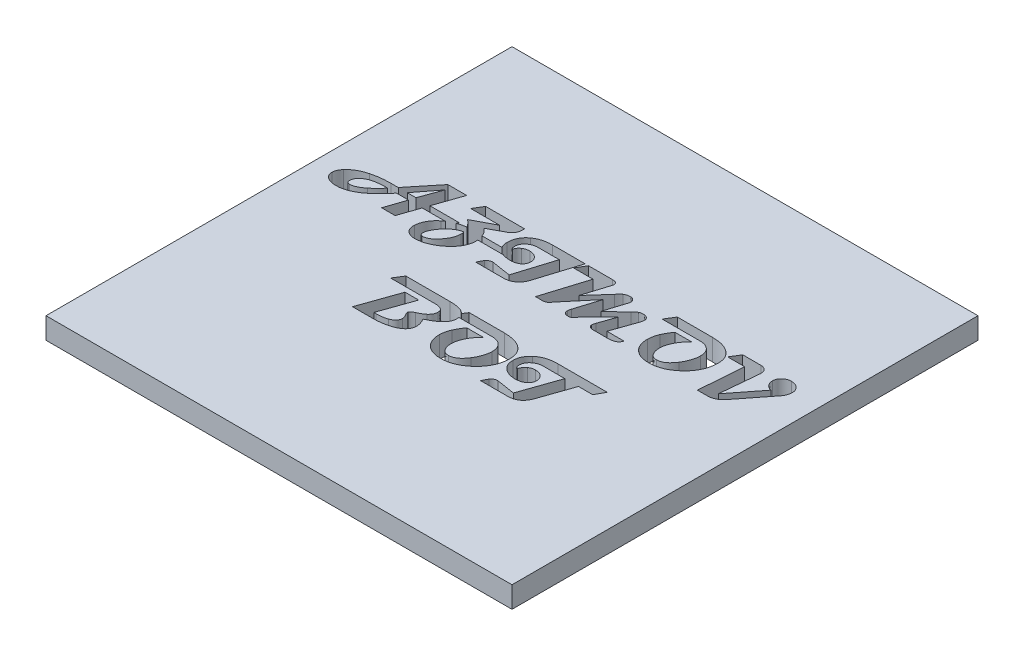
from build123d import *

# Parameters (mm, degrees)
SKETCH_1_W          = 70
SKETCH_1_H          = 70
EXTRUDE_1_DEPTH     = 3.2
CUT_EXTRUDE_1_DEPTH = 3.2


with BuildPart() as part:
    # Эскиз1 → Бобышка-Вытянуть1 (new body)
    with BuildSketch(Plane(origin=(0, 0, 0), x_dir=(1, 0, 0), z_dir=(0, 1, 0))):
        Rectangle(SKETCH_1_W, SKETCH_1_H)
    extrude(amount=EXTRUDE_1_DEPTH)

    # Эскиз2 → Вырез-Вытянуть1 (cut)
    # profile 1 of 9: a face of its own
    with BuildSketch(Plane(origin=(0, 3.2, 0), x_dir=(1, 0, 0), z_dir=(0, 1, 0))):
        with BuildLine():
            add(Edge.make_bspline(
                [(-16.070392755, 8.135936371), (-16.096364615, 8.067361627), (-16.14673298, 7.934371619), (-16.25688386, 7.755695304), (-16.392095575, 7.604144329), (-16.553611031, 7.481302452), (-16.739373402, 7.3854735), (-16.950050176, 7.318683404), (-17.185372254, 7.277876665), (-17.350621164, 7.273406638), (-17.436946809, 7.271071506)],
                knots=[0, 0, 0, 0, 1.006722508, 1.952381103, 2.868174824, 3.7851138, 4.727214408, 5.728830785, 6.813546489, 8, 8, 8, 8], degree=3))
            Line((-17.436946809, 7.271071506), (-20.764649512, 7.271071506))
            Line((-20.764649512, 7.271071506), (-21.800122485, 4.244044479))
            Line((-21.800122485, 4.244044479), (-23.83221708, 4.244044479))
            Line((-23.83221708, 4.244044479), (-22.822081945, 7.271071506))
            Line((-22.822081945, 7.271071506), (-24.616000863, 7.271071506))
            add(Edge.make_bspline(
                [(-24.616000863, 7.271071506), (-24.733291603, 7.126132066), (-24.963048462, 6.842215103), (-25.317200669, 6.437982351), (-25.669386122, 6.061132511), (-26.021448787, 5.712842684), (-26.370467295, 5.390492302), (-26.720900496, 5.098571771), (-27.06841922, 4.831687155), (-27.417180907, 4.595572505), (-27.76335683, 4.38420989), (-28.110099538, 4.204402642), (-28.454140935, 4.047909568), (-28.798711689, 3.924258971), (-29.141798242, 3.823789581), (-29.484454242, 3.756055761), (-29.825940841, 3.710825136), (-30.053358908, 3.705938731), (-30.166676539, 3.703503938)],
                knots=[0, 0, 0, 0, 1.312287539, 2.570595627, 3.781888327, 4.942114945, 6.055705992, 7.124890043, 8.151404632, 9.138534534, 10.088072082, 11.004553681, 11.886233988, 12.746288506, 13.579214241, 14.40000118, 15.202754299, 16, 16, 16, 16], degree=3))
            add(Edge.make_bspline(
                [(-30.166676539, 3.703503938), (-30.293097011, 3.706506954), (-30.537210247, 3.712305666), (-30.886958877, 3.772561189), (-31.209419805, 3.860532159), (-31.402158359, 3.957118713), (-31.496068431, 4.004179614)],
                knots=[0, 0, 0, 0, 1.100618603, 2.125253648, 3.086547243, 4, 4, 4, 4], degree=3))
            add(Edge.make_bspline(
                [(-31.496068431, 4.004179614), (-31.550377502, 4.036728113), (-31.655564165, 4.099768557), (-31.795846337, 4.212225086), (-31.913138131, 4.336792675), (-32.011473624, 4.471022393), (-32.086078885, 4.618525728), (-32.140626612, 4.776921326), (-32.173333955, 4.94709535), (-32.176754542, 5.064283619), (-32.178500863, 5.124112047)],
                knots=[0, 0, 0, 0, 1.098347453, 2.127296654, 3.109202029, 4.061465577, 5.005768685, 5.967169859, 6.962174006, 8, 8, 8, 8], degree=3))
            add(Edge.make_bspline(
                [(-32.178500863, 5.124112047), (-32.176778369, 5.176569147), (-32.173334772, 5.281440997), (-32.148360307, 5.438056632), (-32.110017772, 5.593892482), (-32.053838186, 5.748432435), (-31.979671715, 5.900390977), (-31.893573678, 6.053577227), (-31.790635106, 6.205953668), (-31.710860768, 6.302677036), (-31.670054918, 6.352152587)],
                knots=[0, 0, 0, 0, 0.927183382, 1.853618216, 2.797696976, 3.761361177, 4.754352939, 5.784189041, 6.866577215, 8, 8, 8, 8], degree=3))
            add(Edge.make_bspline(
                [(-31.670054918, 6.352152587), (-31.598882404, 6.431295876), (-31.45458854, 6.591749545), (-31.207741783, 6.808731909), (-30.935288661, 7.010347653), (-30.638581826, 7.198360701), (-30.312983342, 7.36647834), (-29.963279839, 7.522484008), (-29.585935663, 7.660743558), (-29.323112092, 7.738197991), (-29.188635999, 7.777828263)],
                knots=[0, 0, 0, 0, 0.879074717, 1.78222015, 2.7101424, 3.678446659, 4.68172323, 5.735859223, 6.841531581, 8, 8, 8, 8], degree=3))
            add(Edge.make_bspline(
                [(-29.188635999, 7.777828263), (-29.079061436, 7.806892131), (-28.858136731, 7.865490829), (-28.520353912, 7.937222236), (-28.174334669, 7.997961558), (-27.820079942, 8.049012468), (-27.456564752, 8.087098107), (-27.084856298, 8.116192066), (-26.704567799, 8.133423024), (-26.448225444, 8.135092723), (-26.318703566, 8.135936371)],
                knots=[0, 0, 0, 0, 0.937796571, 1.890789484, 2.855809912, 3.844029335, 4.851323956, 5.879251624, 6.928451321, 8, 8, 8, 8], degree=3))
            Line((-26.318703566, 8.135936371), (-25.222419782, 8.135936371))
            Line((-25.222419782, 8.135936371), (-21.879514377, 12.244044479))
            Line((-21.879514377, 12.244044479), (-19.046744107, 12.244044479))
            Line((-19.046744107, 12.244044479), (-20.467352215, 8.135936371))
            Line((-20.467352215, 8.135936371), (-16.070392755, 8.135936371))
        make_face()
        Polygon((-21.404852215, 11.314990425), (-23.867690053, 8.135936371), (-22.56025762, 8.135936371), align=None, mode=Mode.SUBTRACT)
        with BuildLine():
            add(Edge.make_bspline(
                [(-25.967352215, 7.271071506), (-26.1447729, 7.269453592), (-26.485853769, 7.266343246), (-26.976292335, 7.23374566), (-27.425847969, 7.182456649), (-27.834517591, 7.110836091), (-28.203158251, 7.019905127), (-28.529057818, 6.904349517), (-28.817605019, 6.772511614), (-28.983897937, 6.658507274), (-29.063635999, 6.603841776)],
                knots=[0, 0, 0, 0, 1.324242514, 2.545778633, 3.667217228, 4.70031971, 5.641250624, 6.497380107, 7.279488278, 8, 8, 8, 8], degree=3))
            add(Edge.make_bspline(
                [(-29.063635999, 6.603841776), (-29.121796431, 6.557968596), (-29.234082731, 6.469404438), (-29.384729184, 6.327369468), (-29.513395158, 6.183619668), (-29.616745332, 6.0356864), (-29.699416481, 5.886745917), (-29.757550053, 5.735022016), (-29.79294116, 5.580693004), (-29.7977281, 5.476769385), (-29.800122485, 5.424787722)],
                knots=[0, 0, 0, 0, 1.232641781, 2.379775719, 3.442335265, 4.438310833, 5.377907628, 6.270951678, 7.135145538, 8, 8, 8, 8], degree=3))
            add(Edge.make_bspline(
                [(-29.800122485, 5.424787722), (-29.798785388, 5.382942413), (-29.796263246, 5.304010412), (-29.77023232, 5.194450897), (-29.730727956, 5.09940096), (-29.668920967, 5.02389918), (-29.593418238, 4.962065469), (-29.498854576, 4.922888224), (-29.389985768, 4.896351037), (-29.31157647, 4.893966259), (-29.26971708, 4.892693128)],
                knots=[0, 0, 0, 0, 1.164653429, 2.19686333, 3.124788606, 4.007641073, 4.890493541, 5.818418817, 6.835346571, 8, 8, 8, 8], degree=3))
            add(Edge.make_bspline(
                [(-29.26971708, 4.892693128), (-29.207034659, 4.895557775), (-29.075976458, 4.901547261), (-28.875263898, 4.94443927), (-28.663687319, 5.013789624), (-28.440988287, 5.108699007), (-28.207148563, 5.232443444), (-27.961190336, 5.380384797), (-27.705205861, 5.558038836), (-27.534356913, 5.689239446), (-27.445392755, 5.757557993)],
                knots=[0, 0, 0, 0, 0.732737484, 1.532028526, 2.389891822, 3.333978695, 4.358826054, 5.481227477, 6.688429295, 8, 8, 8, 8], degree=3))
            add(Edge.make_bspline(
                [(-27.445392755, 5.757557993), (-27.367349908, 5.81963521), (-27.21397879, 5.941630403), (-26.993759026, 6.128637472), (-26.789700213, 6.319081702), (-26.596719099, 6.506937885), (-26.419258242, 6.696876677), (-26.25459576, 6.886197287), (-26.103987158, 7.076696668), (-26.012378188, 7.207018226), (-25.967352215, 7.271071506)],
                knots=[0, 0, 0, 0, 1.126874848, 2.21455343, 3.263655413, 4.28052085, 5.257361261, 6.200118722, 7.115355124, 8, 8, 8, 8], degree=3))
        make_face(mode=Mode.SUBTRACT)
    # profile 2 of 9: a face of its own
    with BuildSketch(Plane(origin=(0, 3.2, 0), x_dir=(1, 0, 0), z_dir=(0, 1, 0))):
        with BuildLine():
            add(Edge.make_bspline(
                [(-7.854176539, 8.135936371), (-7.877696183, 8.067618904), (-7.922806281, 7.936587682), (-8.016833004, 7.759492125), (-8.12516321, 7.608536147), (-8.25014403, 7.483380128), (-8.394147374, 7.388036286), (-8.553783079, 7.319810428), (-8.729310915, 7.278029904), (-8.851685843, 7.273443789), (-8.91498735, 7.271071506)],
                knots=[0, 0, 0, 0, 1.169855727, 2.243754511, 3.236997406, 4.172926502, 5.094456174, 6.018559138, 6.975049914, 8, 8, 8, 8], degree=3))
            Line((-8.91498735, 7.271071506), (-12.406541404, 7.271071506))
            add(Edge.make_bspline(
                [(-12.406541404, 7.271071506), (-12.403308771, 7.237309943), (-12.395457454, 7.155310924), (-12.394991302, 7.072918669), (-12.39471708, 7.024449884)],
                knots=[0, 0, 0, 0, 0.823462604, 2, 2, 2, 2], degree=3))
            add(Edge.make_bspline(
                [(-12.39471708, 7.024449884), (-12.395974301, 6.955138398), (-12.398483879, 6.816783671), (-12.420011445, 6.610979569), (-12.45131595, 6.407681914), (-12.497468113, 6.207410969), (-12.556775646, 6.009398765), (-12.629230255, 5.813465459), (-12.715875767, 5.62091954), (-12.814785099, 5.430457959), (-12.925126424, 5.241811677), (-13.051591183, 5.057071916), (-13.190261041, 4.874402764), (-13.342144174, 4.694205905), (-13.506822543, 4.516191991), (-13.684011959, 4.340543777), (-13.875443734, 4.167895328), (-14.010259113, 4.057141096), (-14.078838701, 4.000801236)],
                knots=[0, 0, 0, 0, 0.927571818, 1.851553795, 2.767290868, 3.67967176, 4.600142475, 5.532601107, 6.473912777, 7.424562875, 8.404405344, 9.397407607, 10.419476462, 11.473317677, 12.55074901, 13.664656607, 14.812028053, 16, 16, 16, 16], degree=3))
            add(Edge.make_bspline(
                [(-14.078838701, 4.000801236), (-14.21026744, 3.899673051), (-14.468382516, 3.701065735), (-14.872891643, 3.443405712), (-15.28012832, 3.223420252), (-15.69157421, 3.04289874), (-16.108552903, 2.904237993), (-16.528854097, 2.803757665), (-16.953169395, 2.742692479), (-17.237428023, 2.734583986), (-17.379514377, 2.730530966)],
                knots=[0, 0, 0, 0, 1.103288822, 2.166767185, 3.187875272, 4.181405611, 5.153175999, 6.108512499, 7.054542112, 8, 8, 8, 8], degree=3))
            add(Edge.make_bspline(
                [(-17.379514377, 2.730530966), (-17.444905362, 2.731586785), (-17.572699486, 2.733650182), (-17.758995161, 2.756799444), (-17.935799872, 2.790989981), (-18.101323566, 2.843005467), (-18.258893131, 2.904168442), (-18.404129685, 2.984827374), (-18.539948936, 3.078048738), (-18.665651024, 3.183998213), (-18.775838366, 3.304187805), (-18.874651845, 3.432511912), (-18.951223502, 3.574368481), (-19.014808175, 3.724590517), (-19.062454742, 3.884783736), (-19.089986024, 4.056161691), (-19.104513344, 4.236520426), (-19.099817981, 4.360020018), (-19.097419782, 4.423098533)],
                knots=[0, 0, 0, 0, 1.140066112, 2.228040276, 3.270178517, 4.276858321, 5.250853975, 6.213491271, 7.167065881, 8.121651705, 9.073808811, 10.00692904, 10.939014768, 11.876673245, 12.849479528, 13.845803507, 14.899724977, 16, 16, 16, 16], degree=3))
            add(Edge.make_bspline(
                [(-19.097419782, 4.423098533), (-19.08494953, 4.549066897), (-19.060291621, 4.798148987), (-18.975842656, 5.161996827), (-18.853458184, 5.510903894), (-18.692848393, 5.844276167), (-18.492486128, 6.161443709), (-18.254553322, 6.462874214), (-17.978471247, 6.749972345), (-17.770895542, 6.922771625), (-17.66498735, 7.010936371)],
                knots=[0, 0, 0, 0, 0.99517554, 1.967798864, 2.930401569, 3.899355271, 4.872866118, 5.876154129, 6.916382449, 8, 8, 8, 8], degree=3))
            add(Edge.make_bspline(
                [(-17.66498735, 7.010936371), (-17.566418897, 7.086247535), (-17.370247195, 7.236132401), (-17.057281529, 7.432839717), (-16.734273993, 7.610106789), (-16.397845932, 7.761447044), (-16.049119903, 7.890881323), (-15.688404491, 7.996576266), (-15.314868303, 8.080603726), (-15.060551956, 8.11734628), (-14.931879242, 8.135936371)],
                knots=[0, 0, 0, 0, 0.994113199, 1.978491821, 2.960299773, 3.946291997, 4.933317192, 5.940415235, 6.957942087, 8, 8, 8, 8], degree=3))
            add(Edge.make_bspline(
                [(-14.931879242, 8.135936371), (-14.984841829, 8.227498828), (-15.093659314, 8.415624009), (-15.305644047, 8.678052491), (-15.560455943, 8.930614922), (-15.754030221, 9.083742381), (-15.854176539, 9.162963398)],
                knots=[0, 0, 0, 0, 0.911302299, 1.872371208, 2.899263938, 4, 4, 4, 4], degree=3))
            Line((-15.854176539, 9.162963398), (-12.70721708, 10.838639074))
            Line((-12.70721708, 10.838639074), (-17.043365728, 10.838639074))
            Line((-17.043365728, 10.838639074), (-16.193703566, 12.244044479))
            Line((-16.193703566, 12.244044479), (-10.340663026, 12.244044479))
            add(Edge.make_bspline(
                [(-10.340663026, 12.244044479), (-10.341875968, 12.140927636), (-10.344168157, 11.946060038), (-10.371748212, 11.67103315), (-10.421657053, 11.429841746), (-10.476845073, 11.286286291), (-10.502825188, 11.218706641)],
                knots=[0, 0, 0, 0, 1.183493203, 2.236535495, 3.169837784, 4, 4, 4, 4], degree=3))
            add(Edge.make_bspline(
                [(-10.502825188, 11.218706641), (-10.540150422, 11.146053703), (-10.616136734, 10.998147631), (-10.783384017, 10.803701766), (-10.988577431, 10.628484154), (-11.148101618, 10.535519507), (-11.230865728, 10.487287722)],
                knots=[0, 0, 0, 0, 0.930474538, 1.894250073, 2.907497842, 4, 4, 4, 4], degree=3))
            Line((-11.230865728, 10.487287722), (-13.475798161, 9.271071506))
            add(Edge.make_bspline(
                [(-13.475798161, 9.271071506), (-13.425177727, 9.230004161), (-13.325362534, 9.149026092), (-13.18663879, 9.019053429), (-13.062003548, 8.883154652), (-12.946943778, 8.74485436), (-12.848397061, 8.598906281), (-12.759352699, 8.450238306), (-12.684563224, 8.295734556), (-12.644481689, 8.189191999), (-12.624446809, 8.135936371)],
                knots=[0, 0, 0, 0, 1.087185533, 2.143751555, 3.16736264, 4.161990906, 5.141603704, 6.101703701, 7.051130711, 8, 8, 8, 8], degree=3))
            Line((-12.624446809, 8.135936371), (-7.854176539, 8.135936371))
        make_face()
        with BuildLine():
            add(Edge.make_bspline(
                [(-14.465663026, 7.068368803), (-14.475179661, 7.100419183), (-14.496435329, 7.172004584), (-14.535374181, 7.235824944), (-14.556879242, 7.271071506)],
                knots=[0, 0, 0, 0, 0.895444564, 2, 2, 2, 2], degree=3))
            add(Edge.make_bspline(
                [(-14.556879242, 7.271071506), (-14.643099692, 7.25672732), (-14.823657049, 7.226688643), (-15.09627123, 7.126073064), (-15.38420697, 6.985502611), (-15.573792156, 6.864875464), (-15.673433296, 6.801476911)],
                knots=[0, 0, 0, 0, 0.856920467, 1.794508086, 2.840849677, 4, 4, 4, 4], degree=3))
            add(Edge.make_bspline(
                [(-15.673433296, 6.801476911), (-15.767431019, 6.73763567), (-15.9495038, 6.613975735), (-16.196415916, 6.410004059), (-16.414577359, 6.20105144), (-16.537490955, 6.049402622), (-16.597419782, 5.975463398)],
                knots=[0, 0, 0, 0, 1.094589071, 2.120209598, 3.083472954, 4, 4, 4, 4], degree=3))
            add(Edge.make_bspline(
                [(-16.597419782, 5.975463398), (-16.667124921, 5.882711867), (-16.801019263, 5.704548455), (-16.977957108, 5.436183111), (-17.131633215, 5.183946635), (-17.255746822, 4.942924386), (-17.353413604, 4.715796668), (-17.421181969, 4.500682764), (-17.467368108, 4.300060997), (-17.473080999, 4.169376317), (-17.475798161, 4.107220155)],
                knots=[0, 0, 0, 0, 1.328092021, 2.551088958, 3.678808725, 4.708130008, 5.652836618, 6.505075802, 7.288985127, 8, 8, 8, 8], degree=3))
            add(Edge.make_bspline(
                [(-17.475798161, 4.107220155), (-17.474610262, 4.067164028), (-17.472367466, 3.991536575), (-17.453051376, 3.885512739), (-17.417635691, 3.795676745), (-17.367489109, 3.722091587), (-17.303098719, 3.664763655), (-17.225080319, 3.623364214), (-17.132528672, 3.599854308), (-17.066590629, 3.596943215), (-17.031541404, 3.59539583)],
                knots=[0, 0, 0, 0, 1.239488834, 2.340200874, 3.317677693, 4.20728841, 5.071434325, 5.960361776, 6.91583469, 8, 8, 8, 8], degree=3))
            add(Edge.make_bspline(
                [(-17.031541404, 3.59539583), (-16.962589582, 3.598913633), (-16.822453443, 3.606063137), (-16.611922477, 3.657306981), (-16.401552451, 3.743748672), (-16.18940419, 3.862444706), (-15.973589464, 4.011235783), (-15.760024633, 4.198411595), (-15.541451423, 4.414891095), (-15.326966595, 4.660290167), (-15.125107959, 4.92154335), (-14.944614596, 5.187240497), (-14.791792674, 5.453044147), (-14.66611475, 5.718209355), (-14.568144115, 5.983141757), (-14.501550329, 6.248340668), (-14.456093135, 6.51275516), (-14.451202537, 6.689805944), (-14.448771134, 6.777828263)],
                knots=[0, 0, 0, 0, 0.750181602, 1.524652289, 2.344036705, 3.219057828, 4.165961991, 5.191635364, 6.305350033, 7.512582133, 8.7359464, 9.896884334, 11.005935413, 12.069627809, 13.08749009, 14.074460257, 15.042701364, 16, 16, 16, 16], degree=3))
            add(Edge.make_bspline(
                [(-14.448771134, 6.777828263), (-14.448985179, 6.827431539), (-14.449404411, 6.924585366), (-14.460320367, 7.021120878), (-14.465663026, 7.068368803)],
                knots=[0, 0, 0, 0, 1.02112861, 2, 2, 2, 2], degree=3))
        make_face(mode=Mode.SUBTRACT)
    # profile 3 of 9: a face of its own
    with BuildSketch(Plane(origin=(0, 3.2, 0), x_dir=(1, 0, 0), z_dir=(0, 1, 0))):
        with BuildLine():
            Line((-1.259581945, 12.244044479), (-3.220730593, 5.936612047))
            add(Edge.make_bspline(
                [(-3.220730593, 5.936612047), (-3.246936323, 5.868139438), (-3.298450922, 5.733537619), (-3.388307462, 5.541213969), (-3.485390109, 5.361302218), (-3.59464684, 5.196240694), (-3.71330402, 5.044362517), (-3.839111595, 4.903024642), (-3.977035114, 4.778069503), (-4.123348168, 4.665614754), (-4.278669093, 4.566005371), (-4.443531435, 4.479185354), (-4.617796899, 4.406682794), (-4.801630068, 4.347890315), (-4.994321523, 4.299466567), (-5.197477748, 4.269196509), (-5.408892529, 4.247570675), (-5.552879107, 4.245233551), (-5.626135999, 4.244044479)],
                knots=[0, 0, 0, 0, 1.110522855, 2.183039311, 3.213860038, 4.205271667, 5.17797049, 6.132314144, 7.068292583, 7.993124067, 8.925518757, 9.860446867, 10.812652789, 11.781190034, 12.782644766, 13.819133545, 14.890427837, 16, 16, 16, 16], degree=3))
            Line((-5.626135999, 4.244044479), (-9.692014377, 4.244044479))
            add(Edge.make_bspline(
                [(-9.692014377, 4.244044479), (-9.650383959, 4.337230252), (-9.5731093, 4.510202301), (-9.457296777, 4.746177302), (-9.349023427, 4.938941569), (-9.272176632, 5.048032364), (-9.237622485, 5.09708502)],
                knots=[0, 0, 0, 0, 1.264581191, 2.347323997, 3.256874541, 4, 4, 4, 4], degree=3))
            add(Edge.make_bspline(
                [(-9.237622485, 5.09708502), (-9.209064293, 5.132638302), (-9.153802852, 5.201435571), (-9.061371139, 5.291253924), (-8.966478943, 5.368717646), (-8.866717629, 5.430715793), (-8.764050343, 5.48110287), (-8.657378701, 5.516773166), (-8.546422693, 5.537450905), (-8.471378214, 5.54003821), (-8.433568431, 5.541341776)],
                knots=[0, 0, 0, 0, 1.147122396, 2.219735675, 3.238144966, 4.225393035, 5.170097156, 6.111498293, 7.048513083, 8, 8, 8, 8], degree=3))
            add(Edge.make_bspline(
                [(-8.433568431, 5.541341776), (-8.40932497, 5.54061259), (-8.360141552, 5.539133268), (-8.311350147, 5.532752842), (-8.286608972, 5.529517452)],
                knots=[0, 0, 0, 0, 0.985838797, 2, 2, 2, 2], degree=3))
            Line((-8.286608972, 5.529517452), (-5.528163026, 5.088639074))
            Line((-5.528163026, 5.088639074), (-3.739311674, 10.838639074))
            Line((-3.739311674, 10.838639074), (-6.93525762, 10.838639074))
            add(Edge.make_bspline(
                [(-6.93525762, 10.838639074), (-6.993306841, 10.837336958), (-7.108635291, 10.834749999), (-7.279344131, 10.814153615), (-7.44559671, 10.779514748), (-7.608560589, 10.735222919), (-7.765340208, 10.672954016), (-7.918870516, 10.60100032), (-8.065867535, 10.512073743), (-8.159777485, 10.445104449), (-8.20721708, 10.411274209)],
                knots=[0, 0, 0, 0, 1.019526519, 2.025529586, 3.01481339, 4.00117566, 4.987537929, 5.974098542, 6.976594664, 8, 8, 8, 8], degree=3))
            add(Edge.make_bspline(
                [(-8.20721708, 10.411274209), (-8.256497308, 10.372290433), (-8.352960626, 10.295981852), (-8.48029047, 10.167010797), (-8.586742346, 10.029941485), (-8.675188919, 9.885905184), (-8.741839154, 9.733802478), (-8.792233601, 9.574949793), (-8.821103597, 9.407818229), (-8.825109751, 9.293701729), (-8.827149512, 9.235598533)],
                knots=[0, 0, 0, 0, 1.091038346, 2.135647123, 3.139560828, 4.100959047, 5.064495312, 6.017544474, 6.990619221, 8, 8, 8, 8], degree=3))
            add(Edge.make_bspline(
                [(-8.827149512, 9.235598533), (-8.826601829, 9.196722582), (-8.825575724, 9.123887114), (-8.815490165, 9.021043359), (-8.798887827, 8.931081854), (-8.776486583, 8.853380156), (-8.745453172, 8.788899747), (-8.70852438, 8.737164301), (-8.663684016, 8.697567039), (-8.628349771, 8.683440147), (-8.610933296, 8.676476911)],
                knots=[0, 0, 0, 0, 1.465351897, 2.745388579, 3.890327553, 4.911042309, 5.784494135, 6.57422393, 7.297225887, 8, 8, 8, 8], degree=3))
            add(Edge.make_bspline(
                [(-8.610933296, 8.676476911), (-8.601115071, 8.716719104), (-8.581571755, 8.796821756), (-8.536894377, 8.91141667), (-8.482428488, 9.020452218), (-8.418255028, 9.123585641), (-8.343675152, 9.221036365), (-8.256221806, 9.310086088), (-8.160315102, 9.39595518), (-8.08844334, 9.445264044), (-8.051811674, 9.47039583)],
                knots=[0, 0, 0, 0, 0.996723007, 1.98399116, 2.954349569, 3.92896292, 4.905461404, 5.902922178, 6.931159463, 8, 8, 8, 8], degree=3))
            add(Edge.make_bspline(
                [(-8.051811674, 9.47039583), (-7.979784995, 9.514307783), (-7.8359557, 9.601995086), (-7.597690699, 9.693814282), (-7.343538181, 9.746342775), (-7.169173181, 9.753778003), (-7.08052789, 9.757557993)],
                knots=[0, 0, 0, 0, 0.983662164, 1.964264308, 2.965053873, 4, 4, 4, 4], degree=3))
            add(Edge.make_bspline(
                [(-7.08052789, 9.757557993), (-7.031488449, 9.756764428), (-6.935353907, 9.755208762), (-6.793501545, 9.737565191), (-6.657343069, 9.709178779), (-6.525986141, 9.669444071), (-6.398381022, 9.621452768), (-6.27747947, 9.558263778), (-6.161271596, 9.48506812), (-6.088558493, 9.429314915), (-6.051811674, 9.401139074)],
                knots=[0, 0, 0, 0, 1.058707137, 2.075438125, 3.082007763, 4.059352009, 5.037301422, 6.021808005, 7.000286631, 8, 8, 8, 8], degree=3))
            add(Edge.make_bspline(
                [(-6.051811674, 9.401139074), (-6.014444441, 9.369295417), (-5.941240642, 9.306912511), (-5.845798581, 9.200504097), (-5.764963172, 9.087704716), (-5.697423407, 8.968051468), (-5.647393223, 8.840372421), (-5.609729709, 8.70640566), (-5.587265211, 8.565186312), (-5.585039273, 8.468787293), (-5.583906269, 8.419720155)],
                knots=[0, 0, 0, 0, 1.044700222, 2.046606556, 3.035000824, 3.995950724, 4.964651547, 5.948086308, 6.955575133, 8, 8, 8, 8], degree=3))
            add(Edge.make_bspline(
                [(-5.583906269, 8.419720155), (-5.585519156, 8.365582249), (-5.588679459, 8.259504019), (-5.613716126, 8.104788248), (-5.658947052, 7.960233161), (-5.717591775, 7.823096066), (-5.79618702, 7.696210557), (-5.891571279, 7.578160689), (-6.005848099, 7.471698548), (-6.091119681, 7.409296344), (-6.134581945, 7.377490425)],
                knots=[0, 0, 0, 0, 1.054946616, 2.067070532, 3.042536291, 4.000812977, 4.966351335, 5.94157014, 6.950834271, 8, 8, 8, 8], degree=3))
            add(Edge.make_bspline(
                [(-6.134581945, 7.377490425), (-6.174711404, 7.351476094), (-6.255214508, 7.299289136), (-6.384381019, 7.232761576), (-6.521619313, 7.180203095), (-6.664415439, 7.133284334), (-6.815362932, 7.098182556), (-6.973445286, 7.073335665), (-7.138767786, 7.05755181), (-7.25109952, 7.055767925), (-7.308568431, 7.05485529)],
                knots=[0, 0, 0, 0, 0.928253581, 1.862155555, 2.814308934, 3.778933747, 4.778667148, 5.819347094, 6.884378039, 8, 8, 8, 8], degree=3))
            add(Edge.make_bspline(
                [(-7.308568431, 7.05485529), (-7.39701985, 7.05656185), (-7.570303266, 7.059905139), (-7.824933865, 7.08365687), (-8.067651058, 7.123908575), (-8.299072166, 7.18001532), (-8.519691849, 7.250705068), (-8.729179358, 7.338098113), (-8.926778553, 7.443425016), (-9.049642918, 7.525658021), (-9.110933296, 7.566679614)],
                knots=[0, 0, 0, 0, 1.114834829, 2.184050731, 3.220153542, 4.213389733, 5.182990859, 6.137301927, 7.070800804, 8, 8, 8, 8], degree=3))
            add(Edge.make_bspline(
                [(-9.110933296, 7.566679614), (-9.174842818, 7.615177615), (-9.299740937, 7.709957062), (-9.460595463, 7.877514047), (-9.601318869, 8.053942901), (-9.712750865, 8.247703881), (-9.802225661, 8.452365076), (-9.861528983, 8.672240804), (-9.90293227, 8.90408185), (-9.906438764, 9.064233517), (-9.908230593, 9.146071506)],
                knots=[0, 0, 0, 0, 1.043366761, 2.039047436, 3.016053438, 3.975731521, 4.941554289, 5.916659365, 6.935406587, 8, 8, 8, 8], degree=3))
            add(Edge.make_bspline(
                [(-9.908230593, 9.146071506), (-9.904674929, 9.268455704), (-9.89772391, 9.507706361), (-9.843061967, 9.855937131), (-9.751811256, 10.183361428), (-9.622655543, 10.49006024), (-9.45554943, 10.775696048), (-9.252574323, 11.041146038), (-9.01383117, 11.286676647), (-8.830705067, 11.42752112), (-8.737622485, 11.499112047)],
                knots=[0, 0, 0, 0, 1.072866155, 2.09736171, 3.082190949, 4.046960872, 5.007323463, 5.976140993, 6.971277059, 8, 8, 8, 8], degree=3))
            add(Edge.make_bspline(
                [(-8.737622485, 11.499112047), (-8.650234132, 11.558738668), (-8.474556168, 11.678606857), (-8.191146725, 11.829532468), (-7.892485484, 11.95893161), (-7.57746383, 12.063171639), (-7.246509035, 12.144695586), (-6.899598297, 12.200721571), (-6.536846645, 12.237775816), (-6.289519248, 12.241926314), (-6.163298161, 12.244044479)],
                knots=[0, 0, 0, 0, 0.93128516, 1.872174906, 2.822986207, 3.795387517, 4.791394935, 5.822018797, 6.888488863, 8, 8, 8, 8], degree=3))
            Line((-6.163298161, 12.244044479), (-1.259581945, 12.244044479))
        make_face()
    # profile 4 of 9: a face of its own
    with BuildSketch(Plane(origin=(0, 3.2, 0), x_dir=(1, 0, 0), z_dir=(0, 1, 0))):
        with BuildLine():
            add(Edge.make_bspline(
                [(11.713391028, 5.108909344), (11.691006605, 5.040019353), (11.647108506, 4.904919169), (11.531177583, 4.726738381), (11.38483681, 4.573883978), (11.20113809, 4.451305304), (10.98393955, 4.357664399), (10.733622985, 4.290781562), (10.450034282, 4.250791308), (10.249566183, 4.24636985), (10.144134272, 4.244044479)],
                knots=[0, 0, 0, 0, 0.893188068, 1.751631418, 2.604312481, 3.497364589, 4.464694753, 5.519712173, 6.695545641, 8, 8, 8, 8], degree=3))
            Line((10.144134272, 4.244044479), (8.115418055, 4.244044479))
            add(Edge.make_bspline(
                [(8.115418055, 4.244044479), (8.041025206, 4.245488242), (7.901876647, 4.248188738), (7.707723938, 4.272166646), (7.543098716, 4.315427309), (7.406687585, 4.37561083), (7.298001453, 4.453663932), (7.220155012, 4.551638643), (7.173965276, 4.668788797), (7.168794066, 4.75262909), (7.166093731, 4.796409344)],
                knots=[0, 0, 0, 0, 1.447153831, 2.706837734, 3.796448739, 4.747554221, 5.593324767, 6.373548308, 7.150689168, 8, 8, 8, 8], degree=3))
            add(Edge.make_bspline(
                [(7.166093731, 4.796409344), (7.167357455, 4.831436671), (7.170093151, 4.907263479), (7.196868361, 5.026666795), (7.233506048, 5.161222639), (7.26778333, 5.253862118), (7.286026164, 5.303166101)],
                knots=[0, 0, 0, 0, 0.802173736, 1.736537685, 2.795354746, 4, 4, 4, 4], degree=3))
            Line((7.286026164, 5.303166101), (8.145823461, 7.760936371))
            Line((8.145823461, 7.760936371), (5.21001265, 4.833571506))
            add(Edge.make_bspline(
                [(5.21001265, 4.833571506), (5.175918305, 4.778419177), (5.110727242, 4.672963597), (5.004170872, 4.529829247), (4.894321723, 4.40933481), (4.78248504, 4.309493448), (4.667068485, 4.232354705), (4.54854556, 4.177620673), (4.427834839, 4.141060794), (4.345398264, 4.137632667), (4.304607245, 4.135936371)],
                knots=[0, 0, 0, 0, 1.301069805, 2.487747551, 3.57564923, 4.568655862, 5.490211723, 6.349809296, 7.183457582, 8, 8, 8, 8], degree=3))
            add(Edge.make_bspline(
                [(4.304607245, 4.135936371), (4.272470845, 4.137131197), (4.206324291, 4.139590514), (4.140709071, 4.148333128), (4.10697211, 4.152828263)],
                knots=[0, 0, 0, 0, 0.971672669, 2, 2, 2, 2], degree=3))
            add(Edge.make_bspline(
                [(4.10697211, 4.152828263), (4.059933804, 4.160469046), (3.970482278, 4.174999325), (3.846636857, 4.217225214), (3.741034681, 4.276705677), (3.654855034, 4.354248167), (3.587683465, 4.44760085), (3.53932919, 4.556650218), (3.513411102, 4.68204296), (3.509407323, 4.770395964), (3.507309947, 4.816679614)],
                knots=[0, 0, 0, 0, 1.144503209, 2.176472054, 3.128704453, 4.039508999, 4.941413621, 5.874882418, 6.886758864, 8, 8, 8, 8], degree=3))
            add(Edge.make_bspline(
                [(3.507309947, 4.816679614), (3.508811651, 4.855034305), (3.511897279, 4.93384365), (3.531362797, 5.054371257), (3.563096238, 5.179529051), (3.59431723, 5.262332386), (3.610350488, 5.30485529)],
                knots=[0, 0, 0, 0, 0.917351041, 1.884928112, 2.91382396, 4, 4, 4, 4], degree=3))
            Line((3.610350488, 5.30485529), (4.733661299, 8.914652587))
            Line((4.733661299, 8.914652587), (1.313053191, 4.843706641))
            add(Edge.make_bspline(
                [(1.313053191, 4.843706641), (1.285480299, 4.79622421), (1.231915373, 4.703981694), (1.134587116, 4.58139259), (1.027719151, 4.477608601), (0.911655657, 4.391502311), (0.785141216, 4.325076764), (0.649238212, 4.277338174), (0.503297636, 4.250355609), (0.403251897, 4.246184998), (0.351904542, 4.244044479)],
                knots=[0, 0, 0, 0, 1.101622133, 2.140084103, 3.131743923, 4.086212207, 5.03213455, 5.990613784, 6.968705035, 8, 8, 8, 8], degree=3))
            Line((0.351904542, 4.244044479), (-0.719041404, 4.244044479))
            Line((-0.719041404, 4.244044479), (1.331634272, 10.838639074))
            Line((1.331634272, 10.838639074), (-1.583906269, 10.838639074))
            Line((-1.583906269, 10.838639074), (-0.762960323, 12.244044479))
            Line((-0.762960323, 12.244044479), (2.868796434, 12.244044479))
            add(Edge.make_bspline(
                [(2.868796434, 12.244044479), (2.92798704, 12.2424404), (3.039020958, 12.239431355), (3.193909607, 12.217251447), (3.325091982, 12.176579673), (3.433887214, 12.12142714), (3.520584732, 12.048955029), (3.581558171, 11.957616734), (3.617930762, 11.849704823), (3.621830344, 11.772488802), (3.623864001, 11.732220155)],
                knots=[0, 0, 0, 0, 1.374033925, 2.577509854, 3.61927917, 4.548899749, 5.39247498, 6.211802101, 7.067443383, 8, 8, 8, 8], degree=3))
            add(Edge.make_bspline(
                [(3.623864001, 11.732220155), (3.622385814, 11.697794087), (3.619237937, 11.624481955), (3.597605664, 11.510249188), (3.56327494, 11.38556408), (3.532181363, 11.300699372), (3.515755893, 11.255868803)],
                knots=[0, 0, 0, 0, 0.841357506, 1.791715316, 2.833453147, 4, 4, 4, 4], degree=3))
            Line((3.515755893, 11.255868803), (2.399201839, 7.661274209))
            Line((2.399201839, 7.661274209), (4.909336974, 10.477152587))
            add(Edge.make_bspline(
                [(4.909336974, 10.477152587), (4.943014948, 10.517222153), (5.007776598, 10.594274626), (5.102721177, 10.703756286), (5.189584073, 10.804828195), (5.274312591, 10.890876412), (5.349889941, 10.968571665), (5.421461835, 11.032137954), (5.485324187, 11.087433524), (5.527933936, 11.11818446), (5.547850488, 11.132557993)],
                knots=[0, 0, 0, 0, 1.369292302, 2.633104587, 3.791572518, 4.854204317, 5.79164042, 6.625957902, 7.357748359, 8, 8, 8, 8], degree=3))
            add(Edge.make_bspline(
                [(5.547850488, 11.132557993), (5.613153748, 11.170990588), (5.747378202, 11.249985022), (5.978139775, 11.325462501), (6.234034576, 11.371494366), (6.413619492, 11.376544783), (6.507309947, 11.379179614)],
                knots=[0, 0, 0, 0, 0.90309895, 1.856231428, 2.881583943, 4, 4, 4, 4], degree=3))
            add(Edge.make_bspline(
                [(6.507309947, 11.379179614), (6.535586081, 11.377224225), (6.593478406, 11.373220778), (6.681466863, 11.350082223), (6.770820482, 11.311191289), (6.827600881, 11.274729612), (6.85697211, 11.255868803)],
                knots=[0, 0, 0, 0, 0.903088389, 1.848975814, 2.887323343, 4, 4, 4, 4], degree=3))
            add(Edge.make_bspline(
                [(6.85697211, 11.255868803), (6.902073312, 11.222748253), (6.990517462, 11.157798345), (7.083130988, 11.019821574), (7.139713911, 10.860361511), (7.145945511, 10.746244159), (7.149201839, 10.686612047)],
                knots=[0, 0, 0, 0, 0.998091421, 1.957272615, 2.93257119, 4, 4, 4, 4], degree=3))
            add(Edge.make_bspline(
                [(7.149201839, 10.686612047), (7.147203443, 10.645996731), (7.14309742, 10.562546106), (7.120411905, 10.433040774), (7.079125056, 10.297900225), (7.042884246, 10.206633629), (7.024201839, 10.15958502)],
                knots=[0, 0, 0, 0, 0.894726429, 1.838357717, 2.885657312, 4, 4, 4, 4], degree=3))
            Line((7.024201839, 10.15958502), (6.112039677, 7.227152587))
            Line((6.112039677, 7.227152587), (8.449877515, 9.402828263))
            add(Edge.make_bspline(
                [(8.449877515, 9.402828263), (8.486413052, 9.438366073), (8.555780646, 9.505839349), (8.655257391, 9.600654465), (8.746123308, 9.683705732), (8.825179909, 9.758000358), (8.897378237, 9.818521919), (8.957492387, 9.870232769), (9.009965459, 9.90892793), (9.042157306, 9.93051088), (9.056296434, 9.939990425)],
                knots=[0, 0, 0, 0, 1.508135077, 2.863395727, 4.065967825, 5.150831555, 6.072453855, 6.853197448, 7.496307645, 8, 8, 8, 8], degree=3))
            add(Edge.make_bspline(
                [(9.056296434, 9.939990425), (9.10409698, 9.963035647), (9.20603213, 10.012179818), (9.382527016, 10.054771393), (9.585924361, 10.079895678), (9.730749975, 10.081191339), (9.807985623, 10.081882317)],
                knots=[0, 0, 0, 0, 0.822041495, 1.753011813, 2.801678896, 4, 4, 4, 4], degree=3))
            add(Edge.make_bspline(
                [(9.807985623, 10.081882317), (9.841388527, 10.080317464), (9.909821966, 10.077111507), (10.012831193, 10.04759524), (10.117808123, 10.001934494), (10.185166736, 9.960051925), (10.220147785, 9.938301236)],
                knots=[0, 0, 0, 0, 0.904013666, 1.852077441, 2.884528896, 4, 4, 4, 4], degree=3))
            add(Edge.make_bspline(
                [(10.220147785, 9.938301236), (10.247085836, 9.919789512), (10.299327279, 9.883889396), (10.368744011, 9.820181984), (10.425001625, 9.749079515), (10.474466494, 9.673533404), (10.510650134, 9.590506981), (10.538632939, 9.501791842), (10.55346505, 9.406142225), (10.555334729, 9.340373734), (10.556296434, 9.306544479)],
                knots=[0, 0, 0, 0, 1.046144178, 2.028806053, 3.003325329, 3.943878735, 4.912539963, 5.893711324, 6.916590975, 8, 8, 8, 8], degree=3))
            add(Edge.make_bspline(
                [(10.556296434, 9.306544479), (10.555049768, 9.265905233), (10.552470121, 9.181812974), (10.528383633, 9.053078759), (10.493293879, 8.91740958), (10.460240362, 8.826567717), (10.443120758, 8.779517452)],
                knots=[0, 0, 0, 0, 0.899167281, 1.860590824, 2.891923122, 4, 4, 4, 4], degree=3))
            Line((10.443120758, 8.779517452), (9.157647785, 5.108909344))
            Line((9.157647785, 5.108909344), (11.713391028, 5.108909344))
        make_face()
    # profile 5 of 9: a face of its own
    with BuildSketch(Plane(origin=(0, 3.2, 0), x_dir=(1, 0, 0), z_dir=(0, 1, 0))):
        with BuildLine():
            add(Edge.make_bspline(
                [(21.659336974, 9.314990425), (21.65791257, 9.227685354), (21.655088145, 9.054569658), (21.636307652, 8.796851536), (21.604375161, 8.543647037), (21.558878561, 8.294894853), (21.499124347, 8.051001835), (21.427917976, 7.810943143), (21.346217005, 7.573796735), (21.247254239, 7.342774764), (21.136965917, 7.115813118), (21.015651135, 6.891626757), (20.878464213, 6.673060125), (20.729652475, 6.458325444), (20.568716787, 6.247326463), (20.392798936, 6.043106703), (20.206859812, 5.839675788), (20.073353996, 5.711235025), (20.005620758, 5.646071506)],
                knots=[0, 0, 0, 0, 1.010969973, 2.004634655, 2.990481848, 3.964986992, 4.931233747, 5.896754257, 6.863880578, 7.833903808, 8.804978315, 9.785355204, 10.78405567, 11.79148709, 12.80999828, 13.855268444, 14.911885514, 16, 16, 16, 16], degree=3))
            add(Edge.make_bspline(
                [(20.005620758, 5.646071506), (19.87205087, 5.525254935), (19.610189232, 5.288395972), (19.187254402, 4.982439095), (18.755047705, 4.719874517), (18.307841602, 4.508333175), (17.849646195, 4.340637442), (17.378027348, 4.222983177), (16.894211021, 4.149243453), (16.567256551, 4.140393702), (16.402580218, 4.135936371)],
                knots=[0, 0, 0, 0, 1.07857863, 2.114536211, 3.122571453, 4.105109323, 5.074288867, 6.041587056, 7.013611089, 8, 8, 8, 8], degree=3))
            add(Edge.make_bspline(
                [(16.402580218, 4.135936371), (16.283091558, 4.137782231), (16.049636956, 4.141388637), (15.709695039, 4.181821208), (15.389272959, 4.243543161), (15.087201175, 4.329320876), (14.805221915, 4.44293403), (14.541211887, 4.579658343), (14.298045738, 4.74342233), (14.075048543, 4.930434274), (13.875992077, 5.139832949), (13.70162534, 5.368384988), (13.554153027, 5.615996574), (13.434266221, 5.882547735), (13.340363334, 6.16724618), (13.27623885, 6.470371332), (13.233904166, 6.79184294), (13.229279631, 7.012483616), (13.226904542, 7.125801236)],
                knots=[0, 0, 0, 0, 1.160970284, 2.268280994, 3.32236942, 4.330555177, 5.315413223, 6.272629269, 7.215323403, 8.1592878, 9.0961645, 10.017890294, 10.948108455, 11.891199729, 12.853534614, 13.856238146, 14.898997258, 16, 16, 16, 16], degree=3))
            add(Edge.make_bspline(
                [(13.226904542, 7.125801236), (13.231571535, 7.248231646), (13.241112609, 7.498525063), (13.307069323, 7.879461702), (13.413172585, 8.272678445), (13.514371969, 8.532620704), (13.566431569, 8.666341776)],
                knots=[0, 0, 0, 0, 0.925540171, 1.892149264, 2.915666649, 4, 4, 4, 4], degree=3))
            add(Edge.make_bspline(
                [(13.566431569, 8.666341776), (13.622304293, 8.794630469), (13.73345831, 9.049849877), (13.937174428, 9.412756744), (14.162241246, 9.759747127), (14.33375779, 9.974540615), (14.41947211, 10.081882317)],
                knots=[0, 0, 0, 0, 1.011670961, 2.012633054, 3.0068258, 4, 4, 4, 4], degree=3))
            Line((14.41947211, 10.081882317), (16.956634272, 10.081882317))
            add(Edge.make_bspline(
                [(16.956634272, 10.081882317), (16.897011593, 10.032922945), (16.77795714, 9.935160964), (16.607890156, 9.777487949), (16.448545784, 9.607666853), (16.293133122, 9.430682272), (16.149308111, 9.240647843), (16.009327601, 9.04299079), (15.879854186, 8.833815275), (15.800569602, 8.688674154), (15.760688326, 8.615666101)],
                knots=[0, 0, 0, 0, 0.971444459, 1.939778462, 2.917825497, 3.903068954, 4.904359199, 5.917455724, 6.952450547, 8, 8, 8, 8], degree=3))
            add(Edge.make_bspline(
                [(15.760688326, 8.615666101), (15.721933564, 8.540135502), (15.645733496, 8.391626349), (15.550941119, 8.164291219), (15.466749109, 7.941178031), (15.39918322, 7.719427507), (15.346432386, 7.49999792), (15.309846522, 7.28266277), (15.284085501, 7.068424676), (15.281993436, 6.925987505), (15.280958596, 6.855530966)],
                knots=[0, 0, 0, 0, 1.10567561, 2.173992408, 3.206961951, 4.211829707, 5.192298565, 6.145122625, 7.082484992, 8, 8, 8, 8], degree=3))
            add(Edge.make_bspline(
                [(15.280958596, 6.855530966), (15.28418235, 6.744314213), (15.290428249, 6.528836053), (15.348244076, 6.219773315), (15.436074081, 5.934267277), (15.529190019, 5.764728818), (15.574877515, 5.681544479)],
                knots=[0, 0, 0, 0, 1.088602478, 2.109125239, 3.072239019, 4, 4, 4, 4], degree=3))
            add(Edge.make_bspline(
                [(15.574877515, 5.681544479), (15.604773553, 5.636261415), (15.663272922, 5.547653329), (15.767656246, 5.430611329), (15.880214528, 5.330040259), (16.004570276, 5.249079451), (16.138502909, 5.186968038), (16.281301003, 5.140878136), (16.434147627, 5.11294606), (16.539283546, 5.110282063), (16.593458596, 5.108909344)],
                knots=[0, 0, 0, 0, 1.061243055, 2.076597905, 3.060830796, 4.008766904, 4.970514351, 5.943257144, 6.940189547, 8, 8, 8, 8], degree=3))
            add(Edge.make_bspline(
                [(16.593458596, 5.108909344), (16.685093842, 5.113062815), (16.868489145, 5.121375414), (17.138298306, 5.191506025), (17.402059168, 5.300011857), (17.656142297, 5.457252327), (17.904556201, 5.655048455), (18.144206782, 5.898236246), (18.380351722, 6.182093032), (18.521708129, 6.395168538), (18.595147785, 6.505868803)],
                knots=[0, 0, 0, 0, 0.861838573, 1.724851002, 2.609219313, 3.539595153, 4.528448522, 5.59337691, 6.749674147, 8, 8, 8, 8], degree=3))
            add(Edge.make_bspline(
                [(18.595147785, 6.505868803), (18.658254464, 6.608788392), (18.782194752, 6.810920458), (18.94425201, 7.119238533), (19.079593176, 7.425718592), (19.19455079, 7.727056835), (19.280186599, 8.027492048), (19.343508083, 8.323593477), (19.382390019, 8.616876428), (19.386855142, 8.811499553), (19.389066704, 8.90789583)],
                knots=[0, 0, 0, 0, 1.129964018, 2.219227307, 3.257495063, 4.26493309, 5.235857531, 6.178675334, 7.097903101, 8, 8, 8, 8], degree=3))
            add(Edge.make_bspline(
                [(19.389066704, 8.90789583), (19.387581889, 8.982303034), (19.384693086, 9.127067014), (19.358400101, 9.337181187), (19.318494403, 9.534698844), (19.261403842, 9.72031119), (19.184891824, 9.892588658), (19.093419011, 10.052393167), (18.986089734, 10.199982457), (18.860572534, 10.332396375), (18.722563056, 10.452655881), (18.57095225, 10.556983234), (18.405088898, 10.64265838), (18.228021052, 10.715854144), (18.037705489, 10.771477585), (17.835132816, 10.809694199), (17.62049828, 10.833728066), (17.473028317, 10.836975926), (17.39751265, 10.838639074)],
                knots=[0, 0, 0, 0, 1.134089282, 2.206443324, 3.22344522, 4.203726722, 5.160876865, 6.091594335, 7.006858997, 7.936189495, 8.867421601, 9.793773022, 10.734651378, 11.708785435, 12.711223829, 13.751797595, 14.848751983, 16, 16, 16, 16], degree=3))
            Line((17.39751265, 10.838639074), (11.713391028, 10.838639074))
            Line((11.713391028, 10.838639074), (12.591769407, 12.244044479))
            Line((12.591769407, 12.244044479), (17.867107245, 12.244044479))
            add(Edge.make_bspline(
                [(17.867107245, 12.244044479), (17.997800366, 12.242193398), (18.253360459, 12.238573755), (18.627329543, 12.207552951), (18.98287685, 12.157613873), (19.319792661, 12.086586525), (19.638512743, 11.996801703), (19.936673105, 11.881476241), (20.2188582, 11.752425454), (20.392823331, 11.646119093), (20.478593731, 11.593706641)],
                knots=[0, 0, 0, 0, 1.149588221, 2.247929111, 3.298717795, 4.306172768, 5.275078697, 6.20792289, 7.116448396, 8, 8, 8, 8], degree=3))
            add(Edge.make_bspline(
                [(20.478593731, 11.593706641), (20.572738983, 11.527864078), (20.75707401, 11.398945302), (20.99878818, 11.169590844), (21.204115703, 10.917950295), (21.37001716, 10.641422703), (21.502450408, 10.343560287), (21.591915948, 10.020737225), (21.649642774, 9.675733092), (21.656046955, 9.437419313), (21.659336974, 9.314990425)],
                knots=[0, 0, 0, 0, 1.025686277, 2.008278738, 2.96718073, 3.9200415, 4.882239468, 5.871472661, 6.9065121, 8, 8, 8, 8], degree=3))
        make_face()
    # profile 6 of 9: a face of its own
    with BuildSketch(Plane(origin=(0, 3.2, 0), x_dir=(1, 0, 0), z_dir=(0, 1, 0))):
        with BuildLine():
            add(Edge.make_bspline(
                [(31.06474238, 11.066679614), (31.062628031, 11.003506887), (31.058418241, 10.877726387), (31.029623269, 10.691459738), (30.988743244, 10.507641242), (30.926109933, 10.328761696), (30.851430331, 10.151714234), (30.754187629, 9.981262347), (30.646089939, 9.811256997), (30.560720183, 9.705001462), (30.517445082, 9.651139074)],
                knots=[0, 0, 0, 0, 0.978707154, 1.948661721, 2.91598294, 3.892821142, 4.8816289, 5.889352705, 6.930083918, 8, 8, 8, 8], degree=3))
            Line((30.517445082, 9.651139074), (26.905958596, 5.041341776))
            add(Edge.make_bspline(
                [(26.905958596, 5.041341776), (26.840717718, 4.977483222), (26.713524326, 4.852984803), (26.505957412, 4.6923817), (26.296218026, 4.552239055), (26.077484192, 4.440623517), (25.854173893, 4.350636177), (25.622170216, 4.291758518), (25.385522511, 4.249695947), (25.224840259, 4.245933997), (25.144134272, 4.244044479)],
                knots=[0, 0, 0, 0, 1.101167086, 2.146831584, 3.162984297, 4.141875238, 5.10621538, 6.062472704, 7.0268368, 8, 8, 8, 8], degree=3))
            Line((25.144134272, 4.244044479), (23.60528292, 4.244044479))
            Line((23.60528292, 4.244044479), (24.113728866, 10.838639074))
            Line((24.113728866, 10.838639074), (21.551228866, 10.838639074))
            Line((21.551228866, 10.838639074), (22.416093731, 12.244044479))
            Line((22.416093731, 12.244044479), (25.133999137, 12.244044479))
            add(Edge.make_bspline(
                [(25.133999137, 12.244044479), (25.206928492, 12.24034507), (25.34912767, 12.233131886), (25.553645702, 12.180602069), (25.738358076, 12.088244125), (25.901066854, 11.963875017), (26.037317991, 11.812916164), (26.135126252, 11.637966338), (26.19795774, 11.444206429), (26.203685678, 11.307606051), (26.206634272, 11.237287722)],
                knots=[0, 0, 0, 0, 1.065505718, 2.077545265, 3.060248017, 4.064325634, 5.055332967, 6.009784783, 6.975488864, 8, 8, 8, 8], degree=3))
            add(Edge.make_bspline(
                [(26.206634272, 11.237287722), (26.206334468, 11.218691051), (26.205724717, 11.180868558), (26.201848077, 11.143239528), (26.199877515, 11.124112047)],
                knots=[0, 0, 0, 0, 0.983365687, 2, 2, 2, 2], degree=3))
            Line((26.199877515, 11.124112047), (25.659336974, 5.342017452))
            Line((25.659336974, 5.342017452), (29.118796434, 9.757557993))
            add(Edge.make_bspline(
                [(29.118796434, 9.757557993), (29.042915092, 9.777324577), (28.893731654, 9.816185869), (28.688205865, 9.921918395), (28.50072512, 10.056259146), (28.338448228, 10.224926692), (28.204566264, 10.418631226), (28.107253212, 10.632343611), (28.047273386, 10.862981523), (28.040947416, 11.022394508), (28.037715353, 11.103841776)],
                knots=[0, 0, 0, 0, 1.004090812, 1.974052073, 2.947294873, 3.954504149, 4.963191318, 5.956421965, 6.955895284, 8, 8, 8, 8], degree=3))
            add(Edge.make_bspline(
                [(28.037715353, 11.103841776), (28.039044565, 11.149514579), (28.041683445, 11.240188592), (28.061792695, 11.373590257), (28.097779404, 11.501517582), (28.147968294, 11.623635926), (28.207582392, 11.742855489), (28.285640856, 11.855233534), (28.376304207, 11.96252867), (28.479345292, 12.063592639), (28.59160516, 12.156097162), (28.711857564, 12.236869682), (28.837191172, 12.307449898), (28.969712661, 12.36240138), (29.106736959, 12.407219214), (29.25009271, 12.43706176), (29.39868713, 12.456158878), (29.499930512, 12.458881293), (29.551228866, 12.460260695)],
                knots=[0, 0, 0, 0, 0.970634762, 1.926996893, 2.859162603, 3.788172725, 4.730274072, 5.686336591, 6.688556149, 7.712620207, 8.750094909, 9.775836157, 10.788365059, 11.802025121, 12.820197254, 13.848379502, 14.909809319, 16, 16, 16, 16], degree=3))
            add(Edge.make_bspline(
                [(29.551228866, 12.460260695), (29.603085969, 12.458872554), (29.704884355, 12.456147556), (29.854782866, 12.437306661), (29.998663542, 12.405674749), (30.136199877, 12.359026175), (30.268670217, 12.302266257), (30.394494808, 12.230209438), (30.514367729, 12.145875834), (30.626489835, 12.049388272), (30.731422776, 11.946704557), (30.820317231, 11.834386093), (30.897436732, 11.718983818), (30.960676784, 11.598721582), (31.007975213, 11.472540076), (31.041664315, 11.341759556), (31.063119811, 11.205907858), (31.064196796, 11.113494721), (31.06474238, 11.066679614)],
                knots=[0, 0, 0, 0, 1.087543395, 2.134908336, 3.16352863, 4.171881255, 5.176769931, 6.181658606, 7.207223484, 8.246097854, 9.281610379, 10.281280626, 11.244281842, 12.189817004, 13.124223471, 14.06376551, 15.019132683, 16, 16, 16, 16], degree=3))
        make_face()
    # profile 7 of 9: a face of its own
    with BuildSketch(Plane(origin=(0, 3.2, 0), x_dir=(1, 0, 0), z_dir=(0, 1, 0))):
        with BuildLine():
            add(Edge.make_bspline(
                [(-3.746068431, -4.600550116), (-3.748422216, -4.670053677), (-3.753116735, -4.808675455), (-3.79898127, -5.013638765), (-3.865664932, -5.216289792), (-3.963661126, -5.41515763), (-4.0896175, -5.609085527), (-4.242079471, -5.799953863), (-4.421259494, -5.987694104), (-4.556406445, -6.104482112), (-4.626135999, -6.164739305)],
                knots=[0, 0, 0, 0, 0.897728408, 1.790479602, 2.704835107, 3.65271708, 4.64870854, 5.690615823, 6.808464946, 8, 8, 8, 8], degree=3))
            add(Edge.make_bspline(
                [(-4.626135999, -6.164739305), (-4.672498514, -6.202385812), (-4.768974202, -6.280724372), (-4.927576721, -6.393520882), (-5.102537923, -6.509975909), (-5.296401988, -6.627400357), (-5.504866898, -6.751400546), (-5.73209439, -6.875536569), (-5.975135558, -7.004948852), (-6.145020907, -7.088107659), (-6.232554918, -7.130955521)],
                knots=[0, 0, 0, 0, 0.762818378, 1.58734759, 2.485155294, 3.447475053, 4.482567251, 5.583716273, 6.755001493, 8, 8, 8, 8], degree=3))
            add(Edge.make_bspline(
                [(-6.232554918, -7.130955521), (-6.198146336, -7.19312827), (-6.1310504, -7.314363686), (-6.043333822, -7.497155718), (-5.968137611, -7.675039972), (-5.907376577, -7.848857223), (-5.859596781, -8.018049417), (-5.825506416, -8.182824042), (-5.804256017, -8.343234304), (-5.801482275, -8.44902533), (-5.800122485, -8.500887953)],
                knots=[0, 0, 0, 0, 1.174121996, 2.289510624, 3.348879741, 4.364175923, 5.330489301, 6.25208496, 7.143108216, 8, 8, 8, 8], degree=3))
            add(Edge.make_bspline(
                [(-5.800122485, -8.500887953), (-5.801564365, -8.552738675), (-5.804425936, -8.655642154), (-5.82285649, -8.80728013), (-5.854998776, -8.953837489), (-5.901276435, -9.094279216), (-5.958413342, -9.230474568), (-6.030196494, -9.360506638), (-6.113100047, -9.486464384), (-6.209998874, -9.606746989), (-6.320304856, -9.72125088), (-6.442371375, -9.831877625), (-6.578013746, -9.935871415), (-6.724986942, -10.036528806), (-6.887028527, -10.128564884), (-7.059963744, -10.21844825), (-7.247245423, -10.301025263), (-7.377064037, -10.351610384), (-7.443703566, -10.377577143)],
                knots=[0, 0, 0, 0, 0.930762157, 1.847200212, 2.737400411, 3.619588674, 4.498179705, 5.384699949, 6.281759375, 7.202035291, 8.152832479, 9.1332533, 10.156253164, 11.218736018, 12.328253921, 13.499059235, 14.716197083, 16, 16, 16, 16], degree=3))
            add(Edge.make_bspline(
                [(-7.443703566, -10.377577143), (-7.543593089, -10.412404059), (-7.745162281, -10.482682033), (-8.057711814, -10.570115986), (-8.381888654, -10.644226481), (-8.718962517, -10.705061859), (-9.067884772, -10.751919607), (-9.429092493, -10.785589148), (-9.802131127, -10.806253508), (-10.055163298, -10.808745152), (-10.183568431, -10.810009575)],
                knots=[0, 0, 0, 0, 0.910500009, 1.837317329, 2.792105238, 3.772355063, 4.784863345, 5.821858577, 6.894668061, 8, 8, 8, 8], degree=3))
            Line((-10.183568431, -10.810009575), (-13.151473836, -10.810009575))
            Line((-13.151473836, -10.810009575), (-11.097419782, -4.972171737))
            Line((-11.097419782, -4.972171737), (-9.041676539, -4.972171737))
            Line((-9.041676539, -4.972171737), (-10.795054918, -9.94514471))
            Line((-10.795054918, -9.94514471), (-10.509581945, -9.94514471))
            add(Edge.make_bspline(
                [(-10.509581945, -9.94514471), (-10.352946395, -9.942143023), (-10.050900158, -9.936354757), (-9.617099018, -9.894783277), (-9.219470858, -9.824827078), (-8.972956882, -9.749851864), (-8.854176539, -9.713725791)],
                knots=[0, 0, 0, 0, 1.119726035, 2.159209934, 3.113033349, 4, 4, 4, 4], degree=3))
            add(Edge.make_bspline(
                [(-8.854176539, -9.713725791), (-8.775072085, -9.684093213), (-8.623927712, -9.627474436), (-8.419781624, -9.516144327), (-8.24502488, -9.393650748), (-8.102527548, -9.255058368), (-7.989404411, -9.103059747), (-7.911676753, -8.93439237), (-7.86183628, -8.752600052), (-7.856765396, -8.626220037), (-7.854176539, -8.561698764)],
                knots=[0, 0, 0, 0, 1.235683897, 2.361013278, 3.395291283, 4.351587988, 5.260345797, 6.153024808, 7.057056699, 8, 8, 8, 8], degree=3))
            add(Edge.make_bspline(
                [(-7.854176539, -8.561698764), (-7.857121571, -8.516963851), (-7.863413891, -8.421383781), (-7.907712229, -8.273799972), (-7.975775333, -8.114103567), (-8.069306946, -7.952961144), (-8.162161915, -7.797447539), (-8.229889553, -7.65526907), (-8.275415963, -7.537337966), (-8.283249164, -7.464543361), (-8.286608972, -7.433320386)],
                knots=[0, 0, 0, 0, 0.878868266, 1.877779235, 3.008481529, 4.286715377, 5.53601311, 6.565782224, 7.38483702, 8, 8, 8, 8], degree=3))
            add(Edge.make_bspline(
                [(-8.286608972, -7.433320386), (-8.28640634, -7.410127261), (-8.28606816, -7.371419378), (-8.278013206, -7.333610102), (-8.274784647, -7.318455521)],
                knots=[0, 0, 0, 0, 1.198367028, 2, 2, 2, 2], degree=3))
            add(Edge.make_bspline(
                [(-8.274784647, -7.318455521), (-8.248420942, -7.275364691), (-8.190103467, -7.18004621), (-8.049227981, -7.056113012), (-7.860983401, -6.935998325), (-7.715399725, -6.864223694), (-7.636271134, -6.825212278)],
                knots=[0, 0, 0, 0, 0.735710686, 1.627418776, 2.710439134, 4, 4, 4, 4], degree=3))
            add(Edge.make_bspline(
                [(-7.636271134, -6.825212278), (-7.522963532, -6.771362182), (-7.310136649, -6.670214969), (-7.022091967, -6.508683878), (-6.778186886, -6.360018861), (-6.641549266, -6.250483922), (-6.578838701, -6.200212278)],
                knots=[0, 0, 0, 0, 1.221943044, 2.295188721, 3.217567763, 4, 4, 4, 4], degree=3))
            add(Edge.make_bspline(
                [(-6.578838701, -6.200212278), (-6.534150699, -6.160470086), (-6.446843204, -6.082825283), (-6.332079464, -5.955947957), (-6.234605759, -5.8247912), (-6.15418358, -5.689378673), (-6.093061476, -5.5478046), (-6.049382771, -5.402117282), (-6.020575687, -5.252018196), (-6.017759838, -5.150231733), (-6.016338701, -5.098860926)],
                knots=[0, 0, 0, 0, 1.121998031, 2.192061215, 3.204672358, 4.185392352, 5.141656817, 6.09129737, 7.036693171, 8, 8, 8, 8], degree=3))
            add(Edge.make_bspline(
                [(-6.016338701, -5.098860926), (-6.017347213, -5.063352469), (-6.019325857, -4.993686808), (-6.033719153, -4.892372599), (-6.062016741, -4.79890654), (-6.096623894, -4.711102638), (-6.144951979, -4.631540382), (-6.20273597, -4.557677492), (-6.272125067, -4.492368247), (-6.351840531, -4.434001144), (-6.440462784, -4.381885302), (-6.540672261, -4.338173444), (-6.649773506, -4.298721523), (-6.77126856, -4.269605644), (-6.901796442, -4.243542546), (-7.043603803, -4.227503979), (-7.19523424, -4.217168159), (-7.300103078, -4.216011426), (-7.354176539, -4.21541498)],
                knots=[0, 0, 0, 0, 0.937953779, 1.840214304, 2.692042798, 3.512259584, 4.325843598, 5.141056955, 5.982567789, 6.83322717, 7.746330073, 8.691564934, 9.716930283, 10.806196192, 11.987412167, 13.230656729, 14.572045042, 16, 16, 16, 16], degree=3))
            Line((-7.354176539, -4.21541498), (-14.016338701, -4.21541498))
            Line((-14.016338701, -4.21541498), (-13.141338701, -2.810009575))
            Line((-13.141338701, -2.810009575), (-6.507892755, -2.810009575))
            add(Edge.make_bspline(
                [(-6.507892755, -2.810009575), (-6.402572578, -2.810757712), (-6.197980428, -2.812211023), (-5.901605557, -2.829775631), (-5.625263944, -2.855780064), (-5.36969596, -2.894239753), (-5.134469421, -2.944737337), (-4.919508676, -3.005524736), (-4.723390097, -3.074600115), (-4.604220506, -3.134270591), (-4.546744107, -3.163050116)],
                knots=[0, 0, 0, 0, 1.256746755, 2.441322517, 3.541898803, 4.568277561, 5.523823565, 6.410850237, 7.23354099, 8, 8, 8, 8], degree=3))
            add(Edge.make_bspline(
                [(-4.546744107, -3.163050116), (-4.482995218, -3.200068849), (-4.358294302, -3.27248219), (-4.195370891, -3.410436587), (-4.054547759, -3.563110193), (-3.939837302, -3.735555505), (-3.854062885, -3.92737082), (-3.791648978, -4.135696711), (-3.751316412, -4.361951726), (-3.74785576, -4.519289569), (-3.746068431, -4.600550116)],
                knots=[0, 0, 0, 0, 1.016794796, 1.988979663, 2.936190502, 3.879110517, 4.836521918, 5.828337036, 6.878397495, 8, 8, 8, 8], degree=3))
        make_face()
    # profile 8 of 9: a face of its own
    with BuildSketch(Plane(origin=(0, 3.2, 0), x_dir=(1, 0, 0), z_dir=(0, 1, 0))):
        with BuildLine():
            add(Edge.make_bspline(
                [(5.443120758, -5.739063629), (5.441696354, -5.8263687), (5.438871928, -5.999484396), (5.420091436, -6.257202518), (5.388158945, -6.510407017), (5.342662345, -6.759159201), (5.282908131, -7.003052219), (5.21170176, -7.243110911), (5.130000789, -7.480257319), (5.031038023, -7.71127929), (4.920749701, -7.938240936), (4.799434919, -8.162427297), (4.662247997, -8.380993929), (4.513436259, -8.59572861), (4.35250057, -8.806727591), (4.17658272, -9.010947351), (3.990643596, -9.214378266), (3.85713778, -9.342819029), (3.789404542, -9.407982548)],
                knots=[0, 0, 0, 0, 1.010969973, 2.004634655, 2.990481848, 3.964986992, 4.931233747, 5.896754257, 6.863880578, 7.833903808, 8.804978315, 9.785355204, 10.78405567, 11.79148709, 12.80999828, 13.855268444, 14.911885514, 16, 16, 16, 16], degree=3))
            add(Edge.make_bspline(
                [(3.789404542, -9.407982548), (3.655834653, -9.528799119), (3.393973016, -9.765658082), (2.971038186, -10.071614959), (2.538831489, -10.334179537), (2.091625386, -10.545720879), (1.633429979, -10.713416612), (1.161811132, -10.831070877), (0.677994805, -10.904810601), (0.351040335, -10.913660352), (0.186364001, -10.918117683)],
                knots=[0, 0, 0, 0, 1.07857863, 2.114536211, 3.122571453, 4.105109323, 5.074288867, 6.041587056, 7.013611089, 8, 8, 8, 8], degree=3))
            add(Edge.make_bspline(
                [(0.186364001, -10.918117683), (0.066875342, -10.916271823), (-0.16657926, -10.912665417), (-0.506521178, -10.872232846), (-0.826943258, -10.810510893), (-1.129015041, -10.724733178), (-1.410994301, -10.611120024), (-1.675004329, -10.474395711), (-1.918170478, -10.310631724), (-2.141167673, -10.12361978), (-2.340224139, -9.914221105), (-2.514590876, -9.685669066), (-2.662063189, -9.43805748), (-2.781949995, -9.171506319), (-2.875852882, -8.886807874), (-2.939977367, -8.583682722), (-2.98231205, -8.262211114), (-2.986936585, -8.041570438), (-2.989311674, -7.928252818)],
                knots=[0, 0, 0, 0, 1.160970284, 2.268280994, 3.32236942, 4.330555177, 5.315413223, 6.272629269, 7.215323403, 8.1592878, 9.0961645, 10.017890294, 10.948108455, 11.891199729, 12.853534614, 13.856238146, 14.898997258, 16, 16, 16, 16], degree=3))
            add(Edge.make_bspline(
                [(-2.989311674, -7.928252818), (-2.984644681, -7.805822408), (-2.975103607, -7.555528991), (-2.909146893, -7.174592352), (-2.803043631, -6.781375609), (-2.701844248, -6.52143335), (-2.649784647, -6.387712278)],
                knots=[0, 0, 0, 0, 0.925540171, 1.892149264, 2.915666649, 4, 4, 4, 4], degree=3))
            add(Edge.make_bspline(
                [(-2.649784647, -6.387712278), (-2.593911923, -6.259423585), (-2.482757906, -6.004204177), (-2.279041788, -5.64129731), (-2.05397497, -5.294306927), (-1.882458427, -5.079513439), (-1.796744107, -4.972171737)],
                knots=[0, 0, 0, 0, 1.011670961, 2.012633054, 3.0068258, 4, 4, 4, 4], degree=3))
            Line((-1.796744107, -4.972171737), (0.740418055, -4.972171737))
            add(Edge.make_bspline(
                [(0.740418055, -4.972171737), (0.680795376, -5.021131109), (0.561740924, -5.11889309), (0.39167394, -5.276566105), (0.232329568, -5.446387201), (0.076916906, -5.623371782), (-0.066908105, -5.813406211), (-0.206888615, -6.011063264), (-0.33636203, -6.220238779), (-0.415646614, -6.3653799), (-0.45552789, -6.438387953)],
                knots=[0, 0, 0, 0, 0.971444459, 1.939778462, 2.917825497, 3.903068954, 4.904359199, 5.917455724, 6.952450547, 8, 8, 8, 8], degree=3))
            add(Edge.make_bspline(
                [(-0.45552789, -6.438387953), (-0.494282652, -6.513918552), (-0.57048272, -6.662427706), (-0.665275097, -6.889762835), (-0.749467108, -7.112876023), (-0.817032997, -7.334626547), (-0.869783831, -7.554056134), (-0.906369694, -7.771391284), (-0.932130715, -7.985629378), (-0.93422278, -8.128066549), (-0.93525762, -8.198523089)],
                knots=[0, 0, 0, 0, 1.10567561, 2.173992408, 3.206961951, 4.211829707, 5.192298565, 6.145122625, 7.082484992, 8, 8, 8, 8], degree=3))
            add(Edge.make_bspline(
                [(-0.93525762, -8.198523089), (-0.932033866, -8.309739841), (-0.925787967, -8.525218001), (-0.86797214, -8.834280739), (-0.780142135, -9.119786777), (-0.687026197, -9.289325236), (-0.641338701, -9.372509575)],
                knots=[0, 0, 0, 0, 1.088602478, 2.109125239, 3.072239019, 4, 4, 4, 4], degree=3))
            add(Edge.make_bspline(
                [(-0.641338701, -9.372509575), (-0.611442664, -9.417792639), (-0.552943295, -9.506400725), (-0.44855997, -9.623442725), (-0.336001688, -9.724013795), (-0.21164594, -9.804974603), (-0.077713307, -9.867086016), (0.065084787, -9.913175918), (0.21793141, -9.941107994), (0.32306733, -9.943771991), (0.37724238, -9.94514471)],
                knots=[0, 0, 0, 0, 1.061243055, 2.076597905, 3.060830796, 4.008766904, 4.970514351, 5.943257144, 6.940189547, 8, 8, 8, 8], degree=3))
            add(Edge.make_bspline(
                [(0.37724238, -9.94514471), (0.468877626, -9.940991239), (0.652272928, -9.93267864), (0.92208209, -9.862548029), (1.185842952, -9.754042197), (1.439926081, -9.596801727), (1.688339985, -9.399005599), (1.927990566, -9.155817808), (2.164135505, -8.871961022), (2.305491913, -8.658885516), (2.378931569, -8.548185251)],
                knots=[0, 0, 0, 0, 0.861838573, 1.724851002, 2.609219313, 3.539595153, 4.528448522, 5.59337691, 6.749674147, 8, 8, 8, 8], degree=3))
            add(Edge.make_bspline(
                [(2.378931569, -8.548185251), (2.442038248, -8.445265662), (2.565978535, -8.243133596), (2.728035794, -7.934815521), (2.863376959, -7.628335462), (2.978334574, -7.326997219), (3.063970383, -7.026562006), (3.127291866, -6.730460577), (3.166173802, -6.437177626), (3.170638925, -6.242554501), (3.172850488, -6.146158224)],
                knots=[0, 0, 0, 0, 1.129964018, 2.219227307, 3.257495063, 4.26493309, 5.235857531, 6.178675334, 7.097903101, 8, 8, 8, 8], degree=3))
            add(Edge.make_bspline(
                [(3.172850488, -6.146158224), (3.171365673, -6.07175102), (3.16847687, -5.92698704), (3.142183885, -5.716872867), (3.102278187, -5.51935521), (3.045187625, -5.333742864), (2.968675608, -5.161465396), (2.877202795, -5.001660887), (2.769873518, -4.854071597), (2.644356318, -4.721657679), (2.50634684, -4.601398173), (2.354736033, -4.49707082), (2.188872682, -4.411395674), (2.011804836, -4.33819991), (1.821489272, -4.282576469), (1.6189166, -4.244359855), (1.404282064, -4.220325989), (1.2568121, -4.217078128), (1.181296434, -4.21541498)],
                knots=[0, 0, 0, 0, 1.134089282, 2.206443324, 3.22344522, 4.203726722, 5.160876865, 6.091594335, 7.006858997, 7.936189495, 8.867421601, 9.793773022, 10.734651378, 11.708785435, 12.711223829, 13.751797595, 14.848751983, 16, 16, 16, 16], degree=3))
            Line((1.181296434, -4.21541498), (-4.502825188, -4.21541498))
            Line((-4.502825188, -4.21541498), (-3.624446809, -2.810009575))
            Line((-3.624446809, -2.810009575), (1.650891028, -2.810009575))
            add(Edge.make_bspline(
                [(1.650891028, -2.810009575), (1.78158415, -2.811860656), (2.037144243, -2.815480299), (2.411113327, -2.846501103), (2.766660634, -2.896440181), (3.103576445, -2.967467529), (3.422296526, -3.057252351), (3.720456889, -3.172577814), (4.002641984, -3.3016286), (4.176607115, -3.407934961), (4.262377515, -3.460347413)],
                knots=[0, 0, 0, 0, 1.149588221, 2.247929111, 3.298717795, 4.306172768, 5.275078697, 6.20792289, 7.116448396, 8, 8, 8, 8], degree=3))
            add(Edge.make_bspline(
                [(4.262377515, -3.460347413), (4.356522767, -3.526189976), (4.540857793, -3.655108752), (4.782571964, -3.88446321), (4.987899487, -4.13610376), (5.153800944, -4.412631351), (5.286234192, -4.710493767), (5.375699731, -5.033316829), (5.433426557, -5.378320962), (5.439830739, -5.616634742), (5.443120758, -5.739063629)],
                knots=[0, 0, 0, 0, 1.025686277, 2.008278738, 2.96718073, 3.9200415, 4.882239468, 5.871472661, 6.9065121, 8, 8, 8, 8], degree=3))
        make_face()
    # profile 9 of 9: a face of its own
    with BuildSketch(Plane(origin=(0, 3.2, 0), x_dir=(1, 0, 0), z_dir=(0, 1, 0))):
        with BuildLine():
            Line((17.118796434, -2.810009575), (16.340080218, -4.21541498))
            Line((16.340080218, -4.21541498), (14.199877515, -4.21541498))
            Line((14.199877515, -4.21541498), (12.470147785, -9.186698764))
            add(Edge.make_bspline(
                [(12.470147785, -9.186698764), (12.443970749, -9.252388141), (12.392520918, -9.381497767), (12.302069233, -9.565608607), (12.205803723, -9.73877753), (12.095288593, -9.895791933), (11.981750433, -10.044124642), (11.856161962, -10.178236332), (11.720213581, -10.297394837), (11.578239348, -10.407410964), (11.425118972, -10.501269127), (11.264676009, -10.584865294), (11.094193583, -10.653963612), (10.915367491, -10.711721004), (10.727012724, -10.75492374), (10.53077363, -10.78745616), (10.325228818, -10.805862834), (10.185273143, -10.808606853), (10.113728866, -10.810009575)],
                knots=[0, 0, 0, 0, 1.103270031, 2.168429451, 3.199620521, 4.191762064, 5.162180417, 6.113468223, 7.053485222, 7.981553856, 8.91311117, 9.852511752, 10.802337037, 11.780642361, 12.782544432, 13.815568865, 14.883335424, 16, 16, 16, 16], degree=3))
            Line((10.113728866, -10.810009575), (6.091769407, -10.810009575))
            add(Edge.make_bspline(
                [(6.091769407, -10.810009575), (6.132092554, -10.716739905), (6.206998462, -10.543478396), (6.322016512, -10.308564514), (6.426221652, -10.114826357), (6.501937248, -10.005975991), (6.536026164, -9.956969034)],
                knots=[0, 0, 0, 0, 1.265063195, 2.350032525, 3.257146428, 4, 4, 4, 4], degree=3))
            add(Edge.make_bspline(
                [(6.536026164, -9.956969034), (6.564129139, -9.921538271), (6.618223823, -9.853338519), (6.70714593, -9.762227877), (6.800264915, -9.686051634), (6.896976338, -9.622818434), (6.997364635, -9.573452348), (7.101479483, -9.536957608), (7.209787797, -9.516769651), (7.283134456, -9.514064789), (7.319809947, -9.512712278)],
                knots=[0, 0, 0, 0, 1.159198347, 2.231310672, 3.257416092, 4.238651603, 5.187919237, 6.119450276, 7.059669704, 8, 8, 8, 8], degree=3))
            add(Edge.make_bspline(
                [(7.319809947, -9.512712278), (7.34348894, -9.513461654), (7.392105889, -9.51500025), (7.440339099, -9.52130341), (7.465080218, -9.524536602)],
                knots=[0, 0, 0, 0, 0.974104395, 2, 2, 2, 2], degree=3))
            Line((7.465080218, -9.524536602), (10.157647785, -9.946833899))
            Line((10.157647785, -9.946833899), (12.152580218, -4.21541498))
            Line((12.152580218, -4.21541498), (8.887377515, -4.21541498))
            add(Edge.make_bspline(
                [(8.887377515, -4.21541498), (8.828173887, -4.216503514), (8.710476005, -4.218667538), (8.536765766, -4.24242183), (8.366348562, -4.275183783), (8.200592309, -4.324362172), (8.0398434, -4.389077965), (7.883964633, -4.467083956), (7.732549689, -4.558643534), (7.636856862, -4.629070134), (7.588391028, -4.664739305)],
                knots=[0, 0, 0, 0, 1.013778609, 2.015410186, 2.999320669, 3.985357507, 4.972526528, 5.964915095, 6.969284453, 8, 8, 8, 8], degree=3))
            add(Edge.make_bspline(
                [(7.588391028, -4.664739305), (7.537849496, -4.705876146), (7.439074186, -4.786271497), (7.310816265, -4.922613223), (7.2008891, -5.065115079), (7.112498856, -5.217021061), (7.043290106, -5.376447026), (6.991193047, -5.543173696), (6.962886957, -5.718387993), (6.958736644, -5.837506863), (6.956634272, -5.897847413)],
                knots=[0, 0, 0, 0, 1.086627748, 2.12363943, 3.116087313, 4.084801808, 5.04858038, 6.011763107, 6.992843804, 8, 8, 8, 8], degree=3))
            add(Edge.make_bspline(
                [(6.956634272, -5.897847413), (6.957483252, -5.938445856), (6.959093647, -6.015455286), (6.97430294, -6.124236001), (6.998540286, -6.219582419), (7.034867104, -6.300988172), (7.079768705, -6.369913876), (7.137419003, -6.423624908), (7.204769662, -6.464040572), (7.255171362, -6.4783593), (7.280958596, -6.485685251)],
                knots=[0, 0, 0, 0, 1.333279792, 2.529040759, 3.601661997, 4.554096396, 5.446984176, 6.284685238, 7.1223863, 8, 8, 8, 8], degree=3))
            add(Edge.make_bspline(
                [(7.280958596, -6.485685251), (7.311682527, -6.393163898), (7.371635231, -6.212623682), (7.511924077, -5.96778884), (7.68679209, -5.75260812), (7.831472303, -5.640211538), (7.904269407, -5.583658224)],
                knots=[0, 0, 0, 0, 1.044544559, 2.038257047, 3.012932024, 4, 4, 4, 4], degree=3))
            add(Edge.make_bspline(
                [(7.904269407, -5.583658224), (7.974604119, -5.539799416), (8.114514171, -5.452555325), (8.345871018, -5.360491252), (8.591635249, -5.307794672), (8.75987364, -5.300296581), (8.845147785, -5.296496062)],
                knots=[0, 0, 0, 0, 0.994688724, 1.978638253, 2.975442555, 4, 4, 4, 4], degree=3))
            add(Edge.make_bspline(
                [(8.845147785, -5.296496062), (8.899817088, -5.297860224), (9.00610356, -5.30051239), (9.161665456, -5.319237518), (9.30935979, -5.351252985), (9.449102588, -5.396647347), (9.581117324, -5.454708387), (9.704750541, -5.525763522), (9.820299902, -5.610321233), (9.889717256, -5.675807691), (9.924539677, -5.708658224)],
                knots=[0, 0, 0, 0, 1.10504359, 2.148393707, 3.162014064, 4.155494261, 5.113589446, 6.072225393, 7.032953919, 8, 8, 8, 8], degree=3))
            add(Edge.make_bspline(
                [(9.924539677, -5.708658224), (9.954981317, -5.741362399), (10.014747925, -5.805571085), (10.093015721, -5.909533178), (10.159391026, -6.018073557), (10.213361492, -6.131432857), (10.256055063, -6.249017165), (10.287000837, -6.37114256), (10.303319025, -6.498760281), (10.306413729, -6.585306766), (10.307985623, -6.629266332)],
                knots=[0, 0, 0, 0, 1.046511131, 2.05463379, 3.043575607, 4.023319411, 4.99171255, 5.971011965, 6.969415879, 8, 8, 8, 8], degree=3))
            add(Edge.make_bspline(
                [(10.307985623, -6.629266332), (10.306905877, -6.675536395), (10.304786124, -6.766373558), (10.281533842, -6.899410376), (10.246065503, -7.026795147), (10.197437104, -7.149276573), (10.132375319, -7.264480027), (10.053663683, -7.373784369), (9.960907972, -7.477109415), (9.88976604, -7.538785392), (9.853593731, -7.57014471)],
                knots=[0, 0, 0, 0, 1.025441247, 2.013141234, 2.985960218, 3.955485994, 4.928465337, 5.912921898, 6.938819471, 8, 8, 8, 8], degree=3))
            add(Edge.make_bspline(
                [(9.853593731, -7.57014471), (9.809348001, -7.60508929), (9.720482038, -7.675274228), (9.570577658, -7.760673993), (9.410705808, -7.835890905), (9.236263218, -7.894122315), (9.050115032, -7.941925012), (8.850599194, -7.97486707), (8.63894404, -7.99559451), (8.493847015, -7.99797735), (8.41947211, -7.999198764)],
                knots=[0, 0, 0, 0, 0.884755167, 1.77699906, 2.703291664, 3.657392537, 4.661657857, 5.720558626, 6.831587087, 8, 8, 8, 8], degree=3))
            add(Edge.make_bspline(
                [(8.41947211, -7.999198764), (8.337202224, -7.997594763), (8.175078399, -7.994433864), (7.936058875, -7.968853105), (7.706117005, -7.925205268), (7.485283666, -7.863045238), (7.272131219, -7.788989628), (7.069348686, -7.692257924), (6.875231001, -7.580160616), (6.753791556, -7.492378688), (6.693120758, -7.448523089)],
                knots=[0, 0, 0, 0, 1.069711753, 2.108010245, 3.12190551, 4.109656215, 5.08936732, 6.052408321, 7.026988792, 8, 8, 8, 8], degree=3))
            add(Edge.make_bspline(
                [(6.693120758, -7.448523089), (6.62824367, -7.395873988), (6.500222734, -7.291982345), (6.332157105, -7.113697257), (6.191784711, -6.919870311), (6.07493493, -6.713472809), (5.985247623, -6.491957425), (5.920883905, -6.256178246), (5.883814359, -6.005998726), (5.87834632, -5.834905651), (5.875553191, -5.747509575)],
                knots=[0, 0, 0, 0, 1.021931137, 2.016560621, 2.988459753, 3.945087346, 4.912675832, 5.905847597, 6.930285747, 8, 8, 8, 8], degree=3))
            add(Edge.make_bspline(
                [(5.875553191, -5.747509575), (5.878490174, -5.652169938), (5.884291619, -5.4638448), (5.930001538, -5.186985175), (6.001536201, -4.919277723), (6.108070927, -4.664161317), (6.240806213, -4.417945273), (6.40382357, -4.18332522), (6.596128968, -3.957857811), (6.742929183, -3.8209914), (6.818120758, -3.750887953)],
                knots=[0, 0, 0, 0, 1.003473683, 1.982169481, 2.94735515, 3.915214343, 4.886246705, 5.887879359, 6.918164534, 8, 8, 8, 8], degree=3))
            add(Edge.make_bspline(
                [(6.818120758, -3.750887953), (6.908802137, -3.674906657), (7.090936551, -3.522297497), (7.396364376, -3.332395703), (7.724640578, -3.171787352), (8.075841276, -3.037221804), (8.452248158, -2.934811917), (8.852514667, -2.863342555), (9.276000373, -2.818517412), (9.566316464, -2.812892098), (9.715080218, -2.810009575)],
                knots=[0, 0, 0, 0, 0.91068128, 1.82911204, 2.762425373, 3.723717675, 4.722606992, 5.763396117, 6.853919573, 8, 8, 8, 8], degree=3))
            Line((9.715080218, -2.810009575), (17.118796434, -2.810009575))
        make_face()
    extrude(amount=-CUT_EXTRUDE_1_DEPTH, mode=Mode.SUBTRACT)


with BuildPart() as cut_extrude_1_piece_1:
    # of the separate pieces the step leaves, piece 1, a body of its own (cut_extrude_1_pieces)
    add(part.part.solids().sort_by_distance((35, 0, 35))[0])


with BuildPart() as cut_extrude_1_piece_2:
    # of the separate pieces the step leaves, piece 2, a body of its own (cut_extrude_1_pieces)
    add(part.part.solids().sort_by_distance((-16.597419782, 0, -5.975463398))[0])


with BuildPart() as cut_extrude_1_piece_3:
    # of the separate pieces the step leaves, piece 3, a body of its own (cut_extrude_1_pieces)
    add(part.part.solids().sort_by_distance((-25.967352215, 0, -7.271071506))[0])


with BuildPart() as cut_extrude_1_piece_4:
    # of the separate pieces the step leaves, piece 4, a body of its own (cut_extrude_1_pieces)
    add(part.part.solids().sort_by_distance((-21.404852215, 0, -11.314990425))[0])


solid = Compound([cut_extrude_1_piece_1.part, cut_extrude_1_piece_2.part, cut_extrude_1_piece_3.part, cut_extrude_1_piece_4.part])
